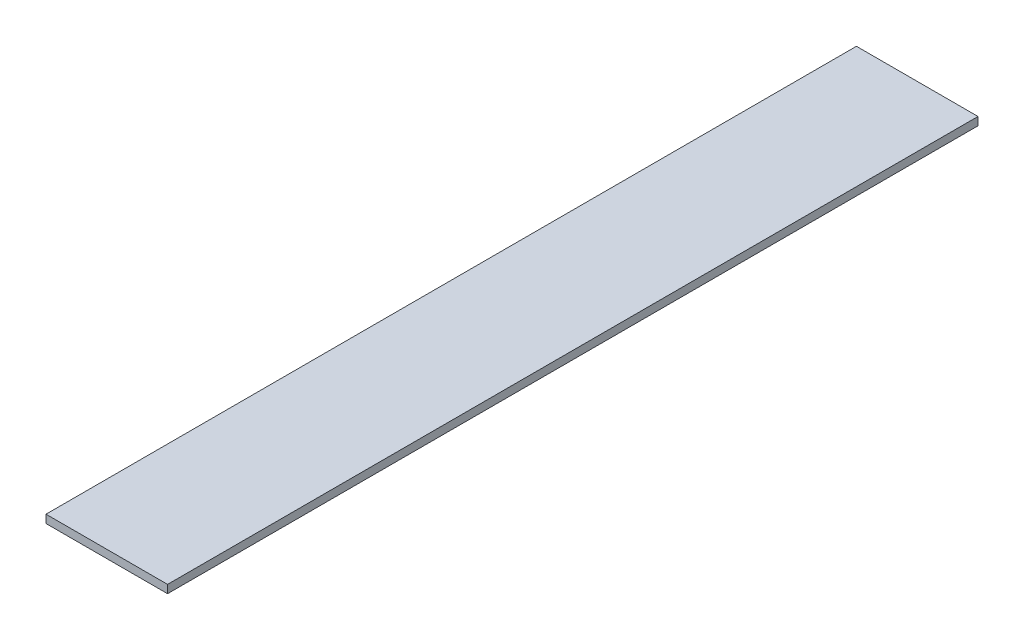
from build123d import *

# Parameters (mm, degrees)
SKETCH1_W           = 30
SKETCH1_H           = 2
BOSS_EXTRUDE1_DEPTH = 200


with BuildPart() as part:
    # Sketch1 → Boss-Extrude1 (new body)
    with BuildSketch(Plane.XY):
        Rectangle(SKETCH1_W, SKETCH1_H)
    extrude(amount=BOSS_EXTRUDE1_DEPTH)


solid = part.part
